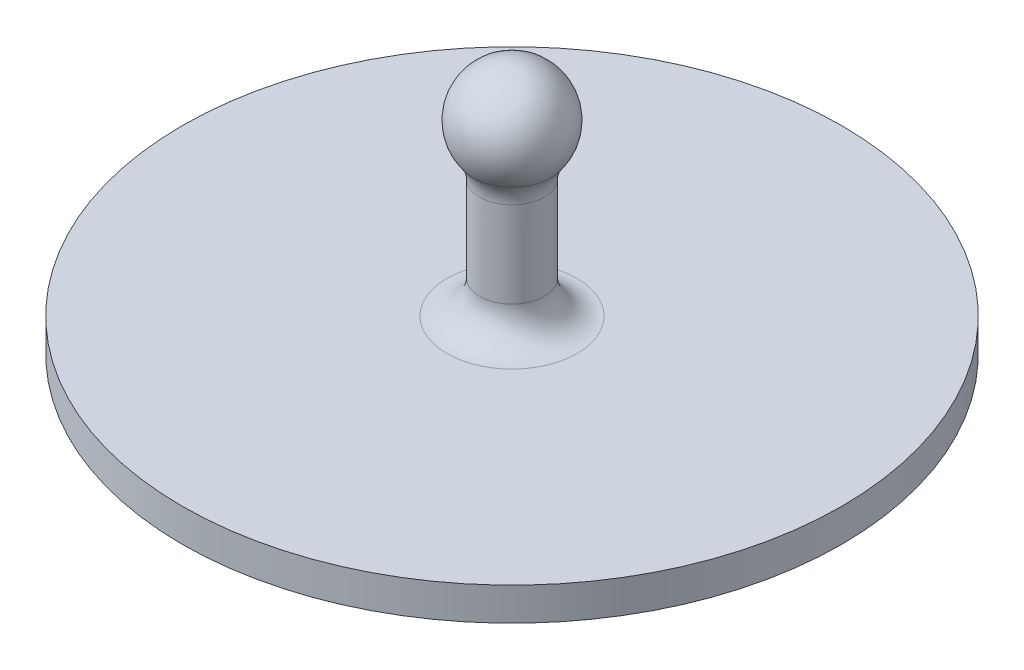
from build123d import *

# Parameters (mm, degrees)
CROQUIS2_R              = 1.95
SALIENTE_EXTRUIR1_DEPTH = 8
C_PULA1_FACE_RADIUS     = 1.95
C_PULA1_HEIGHT          = 5.3
CROQUIS15_R             = 20
SALIENTE_EXTRUIR2_DEPTH = 2
FILLET1_R               = 2
SKETCH1_R               = 19
CUT_EXTRUDE1_DEPTH      = 0.5


with BuildPart() as part:
    # Croquis2 → Saliente-Extruir1 (new body)
    with BuildSketch(Plane(origin=(0, 0, 0), x_dir=(1, 0, 0), z_dir=(0, 1, 0))):
        with Locations(Location((0, 0, 0), (0, 0, 270))):
            Circle(CROQUIS2_R)
    extrude(amount=SALIENTE_EXTRUIR1_DEPTH)

    # Cúpula1: a dome of height H over a round flat face of radius A is a cap of a sphere of radius (A * A + H * H) / (2 * H)
    c_pula1_r = (C_PULA1_FACE_RADIUS * C_PULA1_FACE_RADIUS + C_PULA1_HEIGHT * C_PULA1_HEIGHT) / (2 * C_PULA1_HEIGHT)
    c_pula1_base = Plane((0, 8, 0), z_dir=(0, 1, 0))
    with Locations(c_pula1_base.offset(C_PULA1_HEIGHT - c_pula1_r)):
        c_pula1_ball = Sphere(c_pula1_r, mode=Mode.PRIVATE)
    add(split(c_pula1_ball, bisect_by=c_pula1_base, keep=Keep.TOP, mode=Mode.PRIVATE))

    # Croquis15 → Saliente-Extruir2 (add)
    with BuildSketch(Plane(origin=(0, 0, 0), x_dir=(-1, 0, 0), z_dir=(0, -1, 0))):
        with Locations(Location((0, 0, 0), (0, 0, 90))):
            Circle(CROQUIS15_R)
    extrude(amount=SALIENTE_EXTRUIR2_DEPTH)

    # Fillet1
    fillet1_edges = [part.edges().sort_by_distance(p)[0] for p in [
        (0, 8, -1.95),
        (0, 0, -1.95),
    ]]
    fillet(fillet1_edges, radius=FILLET1_R)

    # Sketch1 → Cut-Extrude1 (cut)
    with BuildSketch(Plane.XZ.offset(2)):
        with Locations(Location((0, 0, 0), (0, 0, 270))):
            Circle(SKETCH1_R)
    extrude(amount=-CUT_EXTRUDE1_DEPTH, mode=Mode.SUBTRACT)


solid = part.part
